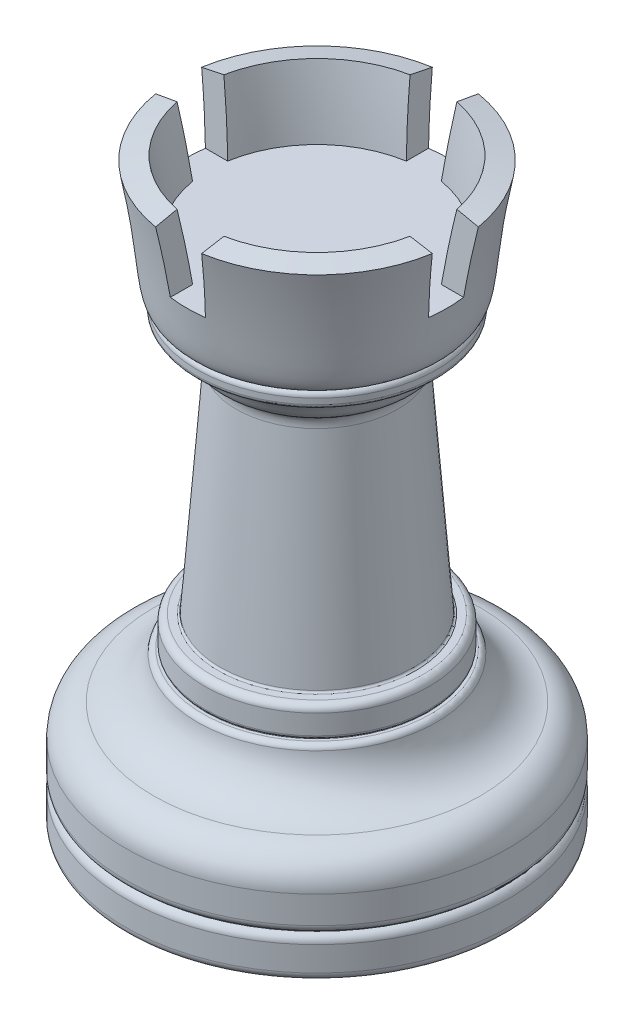
from build123d import *

# Parameters (mm, degrees)
CUT_EXTRUDE2_DEPTH = 6.234191
CUT_EXTRUDE2_TAPER = 5


with BuildPart() as part:
    # Sketch2 → Revolve2 (revolve)
    with BuildSketch(Plane.XY, mode=Mode.PRIVATE) as revolve2_sk:
        with BuildLine():
            Line((185.0870565, 5.238696339), (185.0870565, 53.027975134))
            Line((185.0870565, 53.027975134), (173.867675881, 53.027975134))
            Line((173.867675881, 53.027975134), (173.867675881, 48.572399452))
            ThreePointArc((173.867675881, 48.572399452), (173.995127892, 48.284710859), (174.273882173, 48.138749245))
            Line((174.273882173, 48.138749245), (174.273882173, 48.107583175))
            ThreePointArc((174.273882173, 48.107583175), (174.020521451, 47.912160773), (173.924559497, 47.606918452))
            Line((173.924559497, 47.606918452), (173.924559497, 47.08585736))
            add(Edge.make_bspline(
                [(173.924559497, 47.08585736), (173.924559497, 46.49349858), (175.438832043, 46.436492751), (176.102448469, 44.490822256), (176.691094206, 44.042075344), (177.302147167, 43.70295923), (177.657601034, 43.378080181), (177.596298716, 42.56343019)],
                knots=[0, 0, 0, 0, 0.353428451, 0.425175447, 0.684992791, 0.745722963, 1, 1, 1, 1], degree=3))
            Line((177.596298716, 42.56343019), (176.08995916, 22.545598108))
            ThreePointArc((176.08995916, 22.545598108), (176.030066901, 22.421304127), (175.901629163, 22.370907461))
            Line((175.901629163, 22.370907461), (175.24979788, 22.370907461))
            ThreePointArc((175.24979788, 22.370907461), (174.809941649, 22.188713045), (174.627747233, 21.748856814))
            Line((174.627747233, 21.748856814), (174.627747233, 19.923586966))
            ThreePointArc((174.627747233, 19.923586966), (174.667275566, 19.767298685), (174.776354428, 19.648596042))
            ThreePointArc((174.776354428, 19.648596042), (174.782323495, 19.618587516), (174.756883495, 19.601589052))
            Line((174.756883495, 19.601589052), (174.612573385, 19.601589052))
            Line((174.612573385, 19.601589052), (174.478516391, 19.601589052))
            ThreePointArc((174.478516391, 19.601589052), (174.148400756, 19.479707774), (173.9766903, 19.172548374))
            ThreePointArc((173.9766903, 19.172548374), (172.601651446, 16.53836176), (169.912765925, 15.273622411))
            ThreePointArc((169.912765925, 15.273622411), (168.053057897, 14.308579024), (167.3070565, 12.350696339))
            Line((167.3070565, 12.350696339), (167.3070565, 9.810696339))
            ThreePointArc((167.3070565, 9.810696339), (167.446886106, 9.370755434), (167.8150565, 9.092275849))
            Line((167.8150565, 9.092275849), (167.8150565, 9.005116829))
            ThreePointArc((167.8150565, 9.005116829), (167.446886106, 8.726637244), (167.3070565, 8.286696339))
            Line((167.3070565, 8.286696339), (167.3070565, 6.000696339))
            ThreePointArc((167.3070565, 6.000696339), (167.530241133, 5.461880972), (168.0690565, 5.238696339))
            Line((168.0690565, 5.238696339), (185.0870565, 5.238696339))
        make_face()
    revolve(revolve2_sk.sketch.rotate(Axis((185.0870565, 5.238696339, 0), (0, 1, 0)), 270), axis=Axis((185.0870565, 5.238696339, 0), (0, 1, 0)))

    # Sketch4 → Revolve3 (revolve)
    with BuildSketch(Plane.XY, mode=Mode.PRIVATE) as revolve3_sk:
        with BuildLine():
            Line((172.047087396, 58.868597763), (174.04060886, 59.262166272))
            add(Edge.make_bspline(
                [(175.403982943, 49.822994391), (175.389390525, 49.90697272), (175.364715044, 50.063068897), (175.308016216, 50.474926419), (175.235454961, 51.097606559), (175.134705833, 52.025155474), (175.010860754, 53.121874953), (174.852327537, 54.388927532), (174.647933106, 55.826212655), (174.428844723, 57.173072759), (174.220518423, 58.332093312), (174.101015606, 58.95619122), (174.04060886, 59.262166272)],
                knots=[0.378081826, 0.378081826, 0.378081826, 0.378081826, 0.416951712, 0.455821598, 0.53356137, 0.611301141, 0.689040913, 0.766780685, 0.844520457, 0.922260228, 0.961130114, 1, 1, 1, 1], degree=3))
            Line((175.403982943, 49.822994391), (174.273882173, 48.134238562))
            add(Edge.make_bspline(
                [(174.273882173, 48.134238562), (172.968513182, 48.134238562), (173.603174503, 50.986633191), (172.047087396, 58.868597763)],
                knots=[0, 0, 0, 0, 1, 1, 1, 1], degree=3))
        make_face()
    revolve(revolve3_sk.sketch.rotate(Axis((185.0870565, 59.262166272, 0), (0, -1, 0)), 90), axis=Axis((185.0870565, 59.262166272, 0), (0, -1, 0)))

    # Sketch5 → Cut-Extrude2 (cut)
    with BuildSketch(Plane(origin=(0, 59.262166272, 0), x_dir=(-1, 0, 0), z_dir=(0, -1, 0))):
        Polygon((-187.262551535, 2.175495034), (-205.084201697, 2.175495034), (-205.084201697, -2.175495034), (-187.262551535, -2.175495034), (-187.262551535, -19.997145196), (-182.911561466, -19.997145196), (-182.911561466, -2.175495034), (-165.089911304, -2.175495034), (-165.089911304, 2.175495034), (-182.911561466, 2.175495034), (-182.911561466, 19.997145196), (-187.262551535, 19.997145196), align=None)
    extrude(amount=CUT_EXTRUDE2_DEPTH, taper=CUT_EXTRUDE2_TAPER, mode=Mode.SUBTRACT)


solid = part.part
